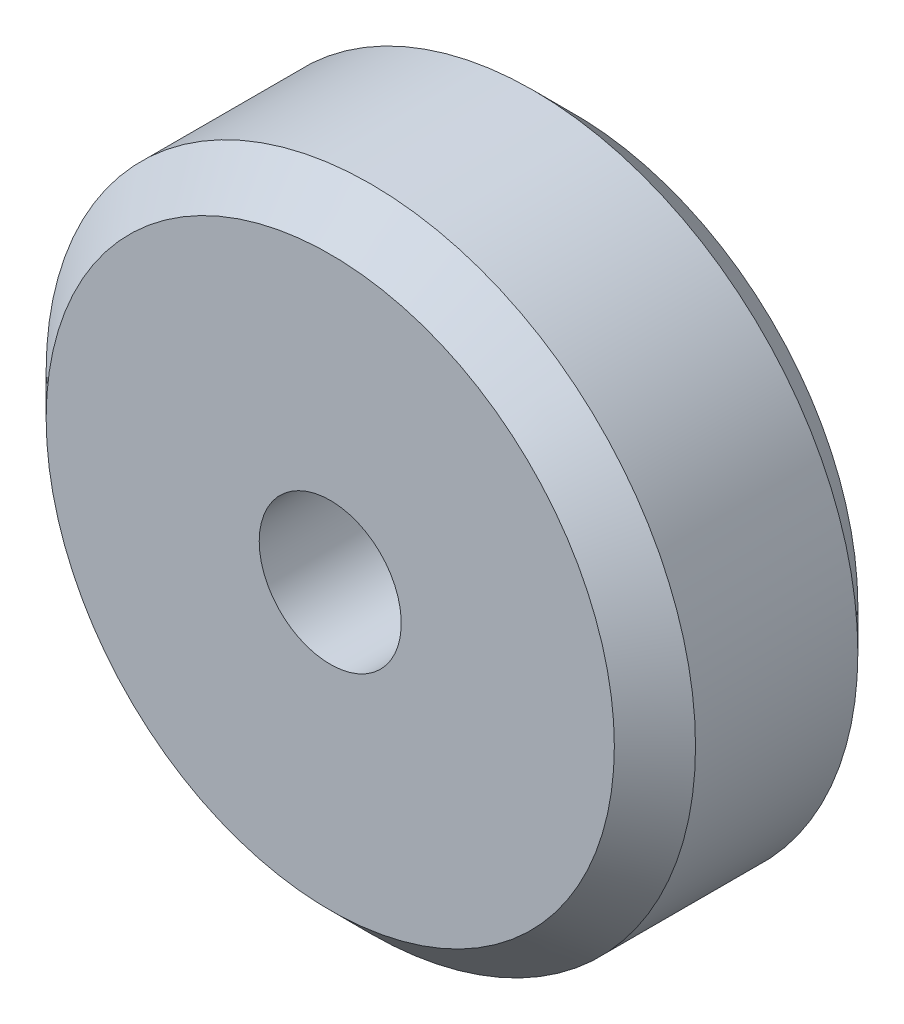
from build123d import *

# Parameters (mm, degrees)
ESQUISSE1_R          = 16
ESQUISSE1_R_2        = 3.5
BASE_EXTRUSION_DEPTH = 12
CHANFREIN1_SIZE      = 2


with BuildPart() as part:
    # Esquisse1 → Base-Extrusion (new body)
    with BuildSketch(Plane.XY):
        with Locations(Location((0, 0, 0), (0, 0, 180))):
            Circle(ESQUISSE1_R)
        with Locations(Location((0, 0, 0), (0, 0, 180))):
            Circle(ESQUISSE1_R_2, mode=Mode.SUBTRACT)
    extrude(amount=BASE_EXTRUSION_DEPTH)

    # Chanfrein1
    chanfrein1_edges = [part.edges().sort_by_distance(p)[0] for p in [
        (16, 0, 12),
        (16, 0, 0),
    ]]
    chamfer(chanfrein1_edges, length=CHANFREIN1_SIZE)


solid = part.part
